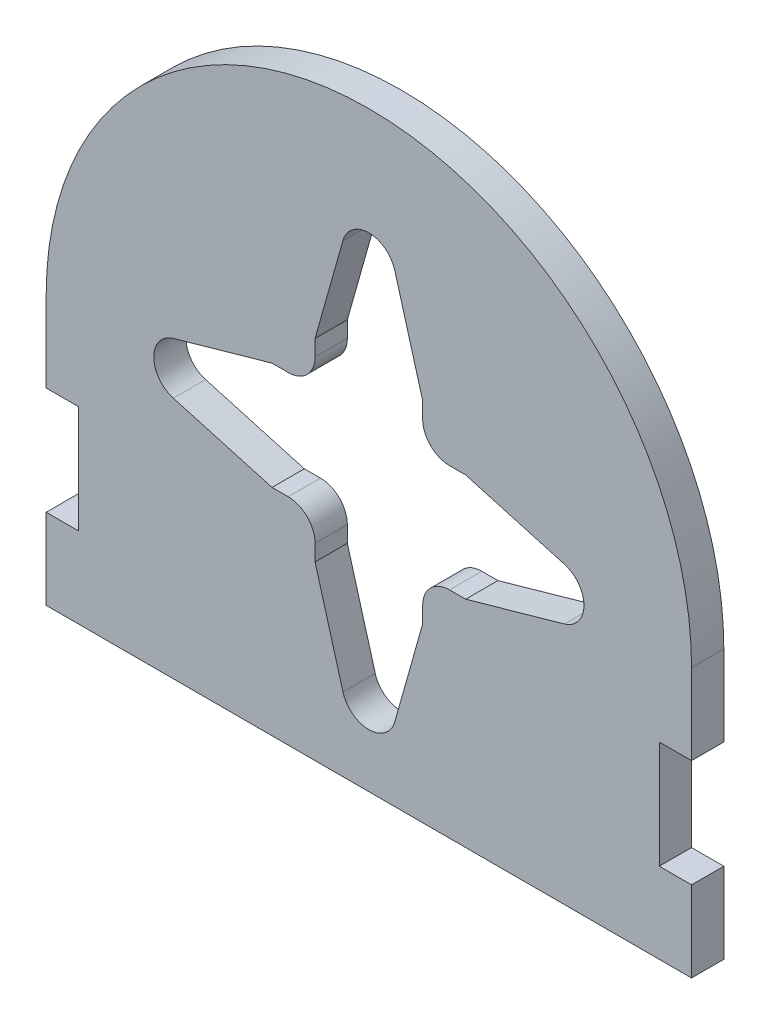
from build123d import *

# Parameters (mm, degrees)
BOSS_EXTRUDE1_DEPTH = 3
SKETCH2_W           = 3
SKETCH2_H           = 10
CUT_EXTRUDE1_DEPTH  = 82.449370777


with BuildPart() as part:
    # Sketch1 → Boss-Extrude1 (new body)
    with BuildSketch(Plane.XY):
        with BuildLine():
            Line((0, 0), (60, 0))
            Line((60, 0), (60, 25))
            ThreePointArc((60, 25), (30, 55), (0, 25))
            Line((0, 25), (0, 0))
        make_face()
        with BuildLine():
            Line((37.5, 20), (39, 20))
            Line((39, 20), (48.179870439, 22.594220254))
            ThreePointArc((48.179870439, 22.594220254), (50, 25), (48.179870439, 27.405779746))
            Line((48.179870439, 27.405779746), (39, 30))
            Line((39, 30), (37.5, 30))
            ThreePointArc((37.5, 30), (35.732233047, 30.732233047), (35, 32.5))
            Line((35, 32.5), (35, 34))
            Line((35, 34), (32.405779746, 43.179870439))
            ThreePointArc((32.405779746, 43.179870439), (30, 45), (27.594220254, 43.179870439))
            Line((27.594220254, 43.179870439), (25, 34))
            Line((25, 34), (25, 32.5))
            ThreePointArc((25, 32.5), (24.267766953, 30.732233047), (22.5, 30))
            Line((22.5, 30), (21, 30))
            Line((21, 30), (11.820129561, 27.405779746))
            ThreePointArc((11.820129561, 27.405779746), (10, 25), (11.820129561, 22.594220254))
            Line((11.820129561, 22.594220254), (21, 20))
            Line((21, 20), (22.5, 20))
            ThreePointArc((22.5, 20), (24.267766953, 19.267766953), (25, 17.5))
            Line((25, 17.5), (25, 16))
            Line((25, 16), (27.594220254, 6.820129561))
            ThreePointArc((27.594220254, 6.820129561), (30, 5), (32.405779746, 6.820129561))
            Line((32.405779746, 6.820129561), (35, 16))
            Line((35, 16), (35, 17.5))
            ThreePointArc((35, 17.5), (35.732233047, 19.267766953), (37.5, 20))
        make_face(mode=Mode.SUBTRACT)
    extrude(amount=BOSS_EXTRUDE1_DEPTH)

    # Sketch2 → Cut-Extrude1 (cut, through all)
    with BuildSketch(Plane(origin=(0, 0, 0), x_dir=(-1, 0, 0), z_dir=(0, 0, -1))):
        with Locations((-58.5, 12.5)):
            Rectangle(SKETCH2_W, SKETCH2_H)
        with Locations((-1.5, 12.5)):
            Rectangle(SKETCH2_W, SKETCH2_H)
    extrude(amount=-CUT_EXTRUDE1_DEPTH, mode=Mode.SUBTRACT)


solid = part.part
